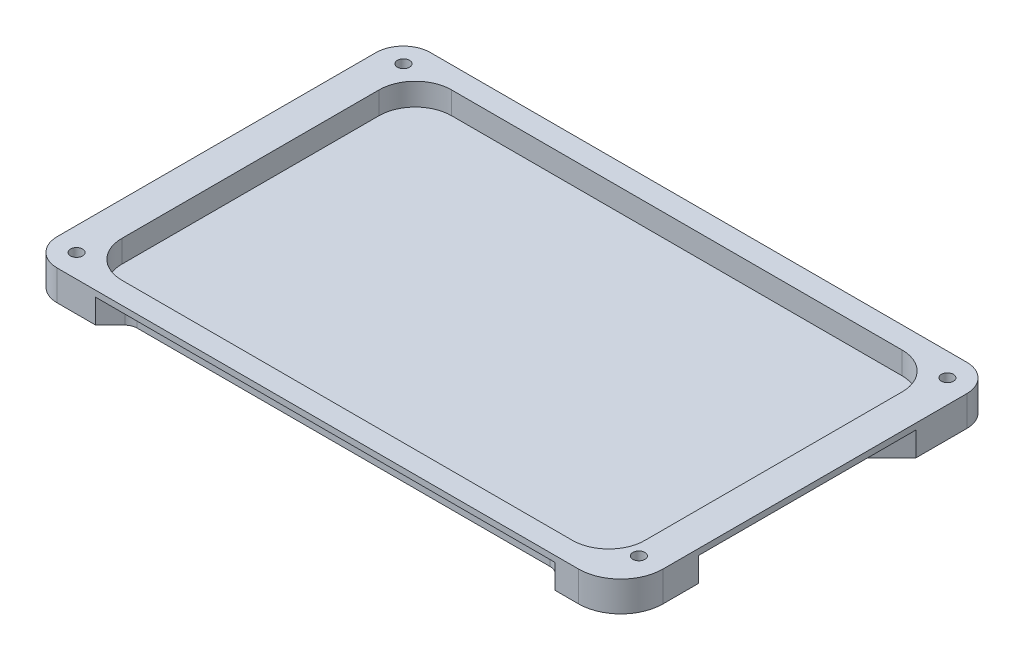
from build123d import *

# Parameters (mm, degrees)
BOSS_EXTRUDE2_DEPTH = 5
CUT_EXTRUDE2_DEPTH  = 4
BOSS_EXTRUDE4_START = 1.2
BOSS_EXTRUDE4_DEPTH = 1.2
CUT_EXTRUDE5_DEPTH  = 1
SKETCH13_R          = 1
CUT_EXTRUDE6_DEPTH  = 58.948522414
CUT_EXTRUDE10_DEPTH = 3.7


with BuildPart() as part:
    # Sketch5 → Boss-Extrude2 (new body)
    with BuildSketch(Plane(origin=(0, 0, 0), x_dir=(1, 0, 0), z_dir=(0, 1, 0))):
        with BuildLine():
            Line((-44.375, -30.875), (41.875, -30.875))
            ThreePointArc((41.875, -30.875), (46.824747468, -28.824747468), (48.875, -23.875))
            Line((48.875, -23.875), (48.875, 26.375))
            ThreePointArc((48.875, 26.375), (47.556980515, 29.556980515), (44.375, 30.875))
            Line((44.375, 30.875), (-44.375, 30.875))
            ThreePointArc((-44.375, 30.875), (-47.556980515, 29.556980515), (-48.875, 26.375))
            Line((-48.875, 26.375), (-48.875, -26.375))
            ThreePointArc((-48.875, -26.375), (-47.556980515, -29.556980515), (-44.375, -30.875))
        make_face()
    extrude(amount=BOSS_EXTRUDE2_DEPTH)

    # Sketch10 → Cut-Extrude2 (cut)
    with BuildSketch(Plane.XZ):
        with BuildLine():
            Line((-48.875, 18), (-44.460786438, 13.585786438))
            ThreePointArc((-44.460786438, 13.585786438), (-44.027240935, 12.93693974), (-43.875, 12.171572875))
            Line((-43.875, 12.171572875), (-43.875, -12.171572875))
            ThreePointArc((-43.875, -12.171572875), (-44.027240935, -12.93693974), (-44.460786438, -13.585786438))
            Line((-44.460786438, -13.585786438), (-48.875, -18))
            Line((-48.875, -18), (-48.875, 18))
        make_face()
        with BuildLine():
            Line((48.875, -18), (48.875, 18))
            Line((48.875, 18), (44.460786438, 13.585786438))
            ThreePointArc((44.460786438, 13.585786438), (44.027240935, 12.93693974), (43.875, 12.171572875))
            Line((43.875, 12.171572875), (43.875, -12.171572875))
            ThreePointArc((43.875, -12.171572875), (44.027240935, -12.93693974), (44.460786438, -13.585786438))
            Line((44.460786438, -13.585786438), (48.875, -18))
        make_face()
        with BuildLine():
            Line((-38, -30.875), (-35.585786438, -28.460786438))
            ThreePointArc((-35.585786438, -28.460786438), (-34.93693974, -28.027240935), (-34.171572875, -27.875))
            Line((-34.171572875, -27.875), (34.171572875, -27.875))
            ThreePointArc((34.171572875, -27.875), (34.93693974, -28.027240935), (35.585786438, -28.460786438))
            Line((35.585786438, -28.460786438), (38, -30.875))
            Line((38, -30.875), (-38, -30.875))
        make_face()
        with BuildLine():
            Line((-38, 30.875), (38, 30.875))
            Line((38, 30.875), (35.585786438, 28.460786438))
            ThreePointArc((35.585786438, 28.460786438), (34.93693974, 28.027240935), (34.171572875, 27.875))
            Line((34.171572875, 27.875), (-34.171572875, 27.875))
            ThreePointArc((-34.171572875, 27.875), (-34.93693974, 28.027240935), (-35.585786438, 28.460786438))
            Line((-35.585786438, 28.460786438), (-38, 30.875))
        make_face()
    extrude(amount=-CUT_EXTRUDE2_DEPTH, mode=Mode.SUBTRACT)

    # Sketch11 → Boss-Extrude4 (add)
    with BuildSketch(Plane.XZ.offset(-4).offset(BOSS_EXTRUDE4_START)):
        with BuildLine():
            Line((-35.585786438, -28.460786438), (-36.5, -29.375))
            Line((-36.5, -29.375), (36.5, -29.375))
            Line((36.5, -29.375), (35.585786438, -28.460786438))
            ThreePointArc((35.585786438, -28.460786438), (34.93693974, -28.027240935), (34.171572875, -27.875))
            Line((34.171572875, -27.875), (-34.171572875, -27.875))
            ThreePointArc((-34.171572875, -27.875), (-34.93693974, -28.027240935), (-35.585786438, -28.460786438))
        make_face()
        with BuildLine():
            Line((-36.5, 29.375), (-35.585786438, 28.460786438))
            ThreePointArc((-35.585786438, 28.460786438), (-34.93693974, 28.027240935), (-34.171572875, 27.875))
            Line((-34.171572875, 27.875), (34.171572875, 27.875))
            ThreePointArc((34.171572875, 27.875), (34.93693974, 28.027240935), (35.585786438, 28.460786438))
            Line((35.585786438, 28.460786438), (36.5, 29.375))
            Line((36.5, 29.375), (-36.5, 29.375))
        make_face()
    extrude(amount=-BOSS_EXTRUDE4_DEPTH)

    # Sketch6 → Cut-Extrude5 (cut)
    with BuildSketch(Plane.XZ):
        with BuildLine():
            Line((-47.975, 26.375), (-47.975, 19.975))
            ThreePointArc((-47.975, 19.975), (-47.345745068, 18.753606113), (-45.985929297, 18.55696973))
            Line((-45.985929297, 18.55696973), (-39.985929297, 20.626336144))
            ThreePointArc((-39.985929297, 20.626336144), (-39.253606113, 21.173621347), (-38.975, 22.044366415))
            Line((-38.975, 22.044366415), (-38.975, 28.475))
            ThreePointArc((-38.975, 28.475), (-39.414339828, 29.535660172), (-40.475, 29.975))
            Line((-40.475, 29.975), (-44.375, 29.975))
            ThreePointArc((-44.375, 29.975), (-46.920584412, 28.920584412), (-47.975, 26.375))
        make_face()
        with BuildLine():
            Line((40.475, 29.975), (41.875, 29.975))
            ThreePointArc((41.875, 29.975), (46.188351365, 28.188351365), (47.975, 23.875))
            Line((47.975, 23.875), (47.975, 19.975))
            ThreePointArc((47.975, 19.975), (47.345745068, 18.753606113), (45.985929297, 18.55696973))
            Line((45.985929297, 18.55696973), (39.985929297, 20.626336144))
            ThreePointArc((39.985929297, 20.626336144), (39.253606113, 21.173621347), (38.975, 22.044366415))
            Line((38.975, 22.044366415), (38.975, 28.475))
            ThreePointArc((38.975, 28.475), (39.414339828, 29.535660172), (40.475, 29.975))
        make_face()
        with BuildLine():
            Line((47.975, -26.375), (47.975, -19.975))
            ThreePointArc((47.975, -19.975), (47.345745068, -18.753606113), (45.985929297, -18.55696973))
            Line((45.985929297, -18.55696973), (39.985929297, -20.626336144))
            ThreePointArc((39.985929297, -20.626336144), (39.253606113, -21.173621347), (38.975, -22.044366415))
            Line((38.975, -22.044366415), (38.975, -28.475))
            ThreePointArc((38.975, -28.475), (39.414339828, -29.535660172), (40.475, -29.975))
            Line((40.475, -29.975), (44.375, -29.975))
            ThreePointArc((44.375, -29.975), (46.920584412, -28.920584412), (47.975, -26.375))
        make_face()
        with BuildLine():
            Line((-40.475, -29.975), (-44.375, -29.975))
            ThreePointArc((-44.375, -29.975), (-46.920584412, -28.920584412), (-47.975, -26.375))
            Line((-47.975, -26.375), (-47.975, -19.975))
            ThreePointArc((-47.975, -19.975), (-47.345745068, -18.753606113), (-45.985929297, -18.55696973))
            Line((-45.985929297, -18.55696973), (-39.985929297, -20.626336144))
            ThreePointArc((-39.985929297, -20.626336144), (-39.253606113, -21.173621347), (-38.975, -22.044366415))
            Line((-38.975, -22.044366415), (-38.975, -28.475))
            ThreePointArc((-38.975, -28.475), (-39.414339828, -29.535660172), (-40.475, -29.975))
        make_face()
    extrude(amount=-CUT_EXTRUDE5_DEPTH, mode=Mode.SUBTRACT)

    # Sketch13 → Cut-Extrude6 (cut, through all)
    with BuildSketch(Plane.XZ.offset(-1)):
        with Locations(Location((-45, 27.04, 0), (0, 0, 270))):
            Circle(SKETCH13_R)
        with Locations(Location((-45, -27.04, 0), (0, 0, 90))):
            Circle(SKETCH13_R)
        with Locations(Location((45, -27.04, 0), (0, 0, 270))):
            Circle(SKETCH13_R)
        with Locations(Location((45, 24, 0), (0, 0, 270))):
            Circle(SKETCH13_R)
    extrude(amount=-CUT_EXTRUDE6_DEPTH, mode=Mode.SUBTRACT)

    # Sketch16 → Cut-Extrude10 (cut)
    with BuildSketch(Plane(origin=(0, 5, 0), x_dir=(1, 0, 0), z_dir=(0, 1, 0))):
        with BuildLine():
            Line((-37.275, 27.275), (37.275, 27.275))
            ThreePointArc((37.275, 27.275), (41.517640687, 25.517640687), (43.275, 21.275))
            Line((43.275, 21.275), (43.275, -21.275))
            ThreePointArc((43.275, -21.275), (41.517640687, -25.517640687), (37.275, -27.275))
            Line((37.275, -27.275), (-37.275, -27.275))
            ThreePointArc((-37.275, -27.275), (-41.517640687, -25.517640687), (-43.275, -21.275))
            Line((-43.275, -21.275), (-43.275, 21.275))
            ThreePointArc((-43.275, 21.275), (-41.517640687, 25.517640687), (-37.275, 27.275))
        make_face()
    extrude(amount=-CUT_EXTRUDE10_DEPTH, mode=Mode.SUBTRACT)


solid = part.part
